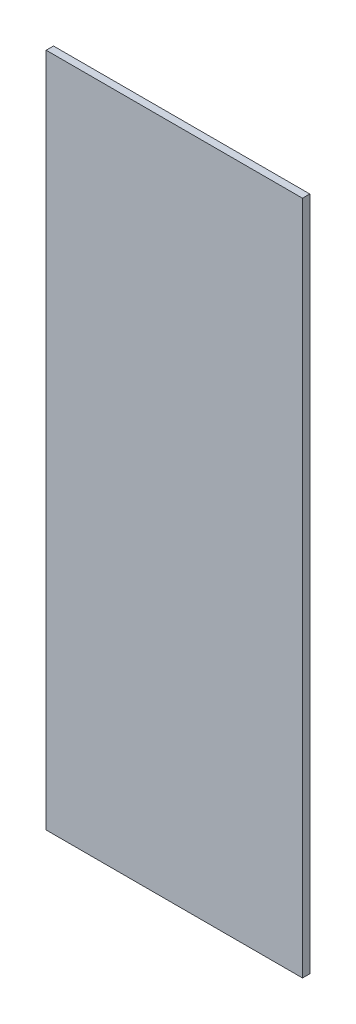
from build123d import *

# Parameters (mm, degrees)
SKETCH1_W           = 63
SKETCH1_H           = 166
BOSS_EXTRUDE1_DEPTH = 1.8


with BuildPart() as part:
    # Sketch1 → Boss-Extrude1 (new body)
    with BuildSketch(Plane.XY):
        with Locations((-89.305773131, 47.559027401)):
            Rectangle(SKETCH1_W, SKETCH1_H)
    extrude(amount=BOSS_EXTRUDE1_DEPTH)


solid = part.part
